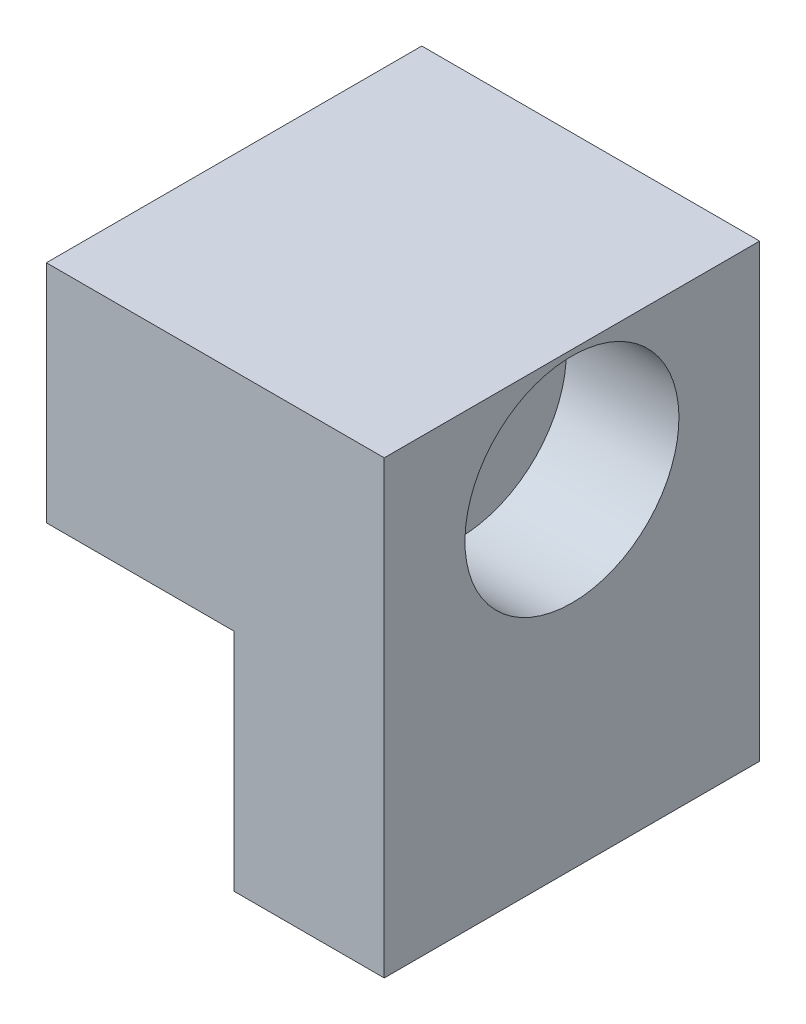
from build123d import *

# Parameters (mm, degrees)
BOSS_EXTRUDE1_DEPTH = 10


with BuildPart() as part:
    # Sketch1 → Boss-Extrude1 (new body)
    with BuildSketch(Plane.XY):
        Polygon((0, 0), (9, 0), (9, -12), (5, -12), (5, -6), (0, -6), align=None)
    extrude(amount=BOSS_EXTRUDE1_DEPTH)

    # Sketch4 → Cut-Revolve2 (revolve, cut)
    with BuildSketch(Plane(origin=(0, -3, 0), x_dir=(1, 0, 0), z_dir=(0, 1, 0)), mode=Mode.PRIVATE) as cut_revolve2_sk:
        Polygon((0, -5), (9, -5), (9, -2.15), (6, -2.15), (6, -3.725), (0, -3.725), align=None)
    revolve(cut_revolve2_sk.sketch.rotate(Axis((0, -3, 5), (1, 0, 0)), 270), axis=Axis((0, -3, 5), (1, 0, 0)), mode=Mode.SUBTRACT)


solid = part.part
